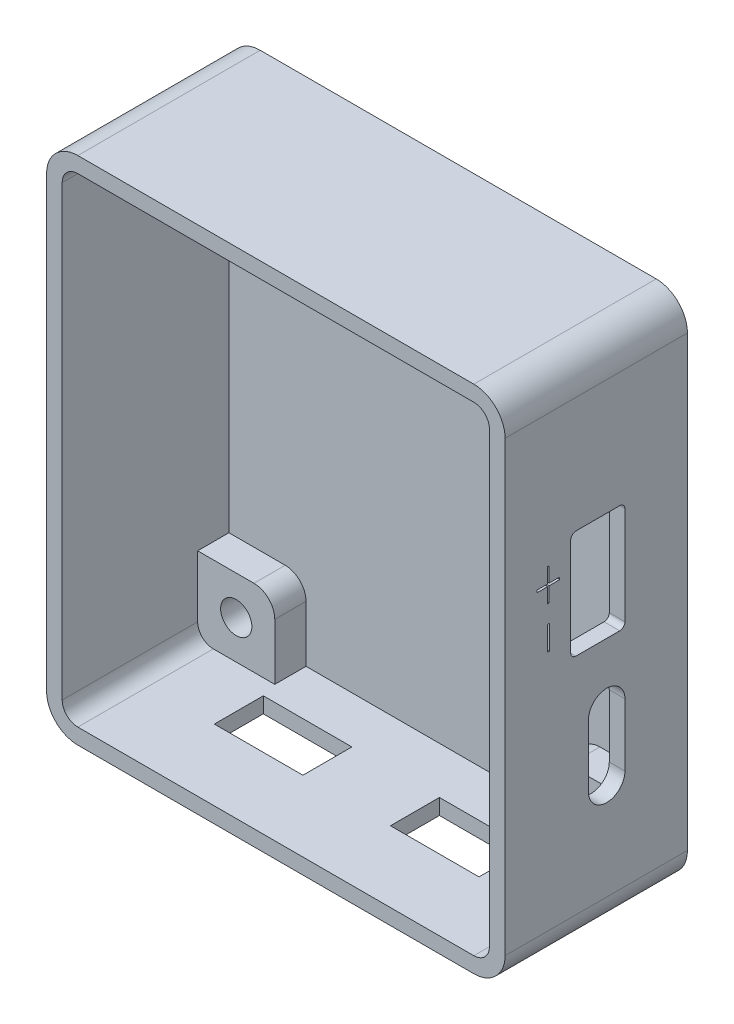
from build123d import *

# Parameters (mm, degrees)
EXTRUDE_1_DEPTH     = 1.5
EXTRUDE_2_DEPTH     = 16
SKETCH_6_R          = 1.5
EXTRUDE_4_DEPTH     = 3
CUT_EXTRUDE_1_DEPTH = 1.5
SKETCH_9_W          = 8.5
SKETCH_9_H          = 4.7
CUT_EXTRUDE_2_DEPTH = 1.5
CUT_EXTRUDE_3_DEPTH = 0.4
SKETCH_11_W         = 0.167941
SKETCH_11_H         = 2.323183833
CUT_EXTRUDE_4_DEPTH = 0.4


with BuildPart() as part:
    # 草图1 → 凸台-拉伸1 (new body)
    with BuildSketch(Plane.XY):
        with BuildLine():
            Line((-19, -24.5), (19, -24.5))
            ThreePointArc((19, -24.5), (21.121320344, -23.621320344), (22, -21.5))
            Line((22, -21.5), (22, 21.5))
            ThreePointArc((22, 21.5), (21.121320344, 23.621320344), (19, 24.5))
            Line((19, 24.5), (-19, 24.5))
            ThreePointArc((-19, 24.5), (-21.121320344, 23.621320344), (-22, 21.5))
            Line((-22, 21.5), (-22, -21.5))
            ThreePointArc((-22, -21.5), (-21.121320344, -23.621320344), (-19, -24.5))
        make_face()
    extrude(amount=EXTRUDE_1_DEPTH)

    # 草图4 → 凸台-拉伸2 (add)
    with BuildSketch(Plane.XY.offset(1.5)):
        with BuildLine():
            Line((-19, -24.5), (19, -24.5))
            ThreePointArc((19, -24.5), (21.121320344, -23.621320344), (22, -21.5))
            Line((22, -21.5), (22, 21.5))
            ThreePointArc((22, 21.5), (21.121320344, 23.621320344), (19, 24.5))
            Line((19, 24.5), (-19, 24.5))
            ThreePointArc((-19, 24.5), (-21.121320344, 23.621320344), (-22, 21.5))
            Line((-22, 21.5), (-22, -21.5))
            ThreePointArc((-22, -21.5), (-21.121320344, -23.621320344), (-19, -24.5))
        make_face()
        with BuildLine():
            Line((20.5, -21.5), (20.5, 21.5))
            ThreePointArc((20.5, 21.5), (20.060660172, 22.560660172), (19, 23))
            Line((19, 23), (-19, 23))
            ThreePointArc((-19, 23), (-20.060660172, 22.560660172), (-20.5, 21.5))
            Line((-20.5, 21.5), (-20.5, -21.5))
            ThreePointArc((-20.5, -21.5), (-20.060660172, -22.560660172), (-19, -23))
            Line((-19, -23), (19, -23))
            ThreePointArc((19, -23), (20.060660172, -22.560660172), (20.5, -21.5))
        make_face(mode=Mode.SUBTRACT)
    extrude(amount=EXTRUDE_2_DEPTH)

    # 草图6 → 凸台-拉伸4 (add)
    # profile 1 of 4: a face of its own
    with BuildSketch(Plane.XY.offset(1.5)):
        with BuildLine():
            Line((-13.1, 17.6), (-13.1, 23))
            Line((-13.1, 23), (-19, 23))
            ThreePointArc((-19, 23), (-20.060660172, 22.560660172), (-20.5, 21.5))
            Line((-20.5, 21.5), (-20.5, 15.6))
            Line((-20.5, 15.6), (-15.1, 15.6))
            ThreePointArc((-15.1, 15.6), (-13.685786438, 16.185786438), (-13.1, 17.6))
        make_face()
        with Locations((-16.8, 19.3)):
            Circle(SKETCH_6_R, mode=Mode.SUBTRACT)
    # profile 2 of 4: a face of its own
    with BuildSketch(Plane.XY.offset(1.5)):
        with BuildLine():
            Line((19, 23), (13.1, 23))
            Line((13.1, 23), (13.1, 17.6))
            ThreePointArc((13.1, 17.6), (13.685786438, 16.185786438), (15.1, 15.6))
            Line((15.1, 15.6), (20.5, 15.6))
            Line((20.5, 15.6), (20.5, 21.5))
            ThreePointArc((20.5, 21.5), (20.060660172, 22.560660172), (19, 23))
        make_face()
        with Locations((16.8, 19.3)):
            Circle(SKETCH_6_R, mode=Mode.SUBTRACT)
    # profile 3 of 4: a face of its own
    with BuildSketch(Plane.XY.offset(1.5)):
        with BuildLine():
            Line((-15.1, -15.6), (-20.5, -15.6))
            Line((-20.5, -15.6), (-20.5, -21.5))
            ThreePointArc((-20.5, -21.5), (-20.060660172, -22.560660172), (-19, -23))
            Line((-19, -23), (-13.1, -23))
            Line((-13.1, -23), (-13.1, -17.6))
            ThreePointArc((-13.1, -17.6), (-13.685786438, -16.185786438), (-15.1, -15.6))
        make_face()
        with Locations((-16.8, -19.3)):
            Circle(SKETCH_6_R, mode=Mode.SUBTRACT)
    # profile 4 of 4: a face of its own
    with BuildSketch(Plane.XY.offset(1.5)):
        with BuildLine():
            Line((20.5, -21.5), (20.5, -15.6))
            Line((20.5, -15.6), (15.1, -15.6))
            ThreePointArc((15.1, -15.6), (13.685786438, -16.185786438), (13.1, -17.6))
            Line((13.1, -17.6), (13.1, -23))
            Line((13.1, -23), (19, -23))
            ThreePointArc((19, -23), (20.060660172, -22.560660172), (20.5, -21.5))
        make_face()
        with Locations((16.8, -19.3)):
            Circle(SKETCH_6_R, mode=Mode.SUBTRACT)
    extrude(amount=EXTRUDE_4_DEPTH)

    # 草图7 → 切除-拉伸1 (cut)
    with BuildSketch(Plane(origin=(22, 0, 0), x_dir=(0, 0, -1), z_dir=(1, 0, 0))):
        with BuildLine():
            Line((-10.7, 10.4), (-6.5, 10.4))
            ThreePointArc((-6.5, 10.4), (-6.146446609, 10.253553391), (-6, 9.9))
            Line((-6, 9.9), (-6, 0.5))
            ThreePointArc((-6, 0.5), (-6.146446609, 0.146446609), (-6.5, 0))
            Line((-6.5, 0), (-10.7, 0))
            ThreePointArc((-10.7, 0), (-11.053553391, 0.146446609), (-11.2, 0.5))
            Line((-11.2, 0.5), (-11.2, 9.9))
            ThreePointArc((-11.2, 9.9), (-11.053553391, 10.253553391), (-10.7, 10.4))
        make_face()
        with BuildLine():
            Line((-6, -5.9), (-6, -11.9))
            ThreePointArc((-6, -11.9), (-7.75, -13.65), (-9.5, -11.9))
            Line((-9.5, -11.9), (-9.5, -5.9))
            ThreePointArc((-9.5, -5.9), (-7.75, -4.15), (-6, -5.9))
        make_face()
    extrude(amount=-CUT_EXTRUDE_1_DEPTH, mode=Mode.SUBTRACT)

    # 草图9 → 切除-拉伸2 (cut)
    with BuildSketch(Plane.XZ.offset(24.5)):
        with Locations((-8.45, 8.35)):
            Rectangle(SKETCH_9_W, SKETCH_9_H)
        with Locations((8.45, 8.35)):
            Rectangle(SKETCH_9_W, SKETCH_9_H)
    extrude(amount=-CUT_EXTRUDE_2_DEPTH, mode=Mode.SUBTRACT)

    # 草图10 → 切除-拉伸3 (cut)
    with BuildSketch(Plane.XZ.offset(24.5)):
        with BuildLine():
            Line((5.146024561, 15.278113511), (5.181076766, 15.318386258))
            Line((5.181076766, 15.318386258), (5.402576872, 15.041697573))
            add(Edge.make_bspline(
                [(5.402576872, 15.041697573), (5.396175093, 15.029735511), (5.383530326, 15.006108099), (5.362631994, 14.969707555), (5.346248836, 14.924148855), (5.335651242, 14.866845568), (5.328158802, 14.798513844), (5.327563807, 14.749619769), (5.32725192, 14.723990349)],
                knots=[0, 0, 0, 0, 0.736410598, 1.454555069, 2.274010016, 3.348139226, 4.609940921, 6, 6, 6, 6], degree=3))
            Line((5.32725192, 14.723990349), (5.32725192, 12.156975646))
            add(Edge.make_bspline(
                [(5.32725192, 12.156975646), (5.347889467, 12.156755128), (5.385690735, 12.156351211), (5.436370188, 12.158787957), (5.475961496, 12.158570324), (5.508306264, 12.16126774), (5.542791059, 12.165884302), (5.58751146, 12.171810361), (5.647268407, 12.179055459), (5.716844174, 12.189019446), (5.78743923, 12.19951043), (5.849133517, 12.208952893), (5.89708996, 12.217378293), (5.942200811, 12.225183856), (5.986499646, 12.24055664), (6.025373314, 12.268914573), (6.05036684, 12.297684791), (6.06982158, 12.30500879), (6.076772483, 12.30762555)],
                knots=[0, 0, 0, 0, 1.271684107, 2.329311289, 3.126176351, 3.710204741, 4.32783396, 5.270448411, 6.49050515, 8.03759688, 9.602040843, 10.889228832, 11.884182716, 12.602334394, 13.712376462, 14.732953672, 15.547302315, 16, 16, 16, 16], degree=3))
            add(Edge.make_bspline(
                [(6.076772483, 12.30762555), (6.080022607, 12.305162426), (6.08946356, 12.298007547), (6.108330709, 12.281752984), (6.139611472, 12.255975297), (6.177541129, 12.219223825), (6.21647205, 12.183206306), (6.247439777, 12.154585227), (6.269681945, 12.134169304), (6.278294564, 12.113029312), (6.281887459, 12.095947906), (6.282921417, 12.085886832), (6.283356757, 12.081650694)],
                knots=[0, 0, 0, 0, 0.390394386, 1.134016561, 2.38360509, 4.269889804, 6.18981564, 7.453157385, 8.329021544, 9.032311711, 9.592562279, 10, 10, 10, 10], degree=3))
            add(Edge.make_bspline(
                [(6.283356757, 12.081650694), (6.281275092, 12.076854821), (6.277089785, 12.067212444), (6.262302219, 12.057859746), (6.243193914, 12.052892807), (6.209951113, 12.053453591), (6.162321804, 12.055027694), (6.100540552, 12.045441014), (6.034228292, 12.036243207), (5.981590364, 12.028012382), (5.941598849, 12.022204449), (5.91243486, 12.019632793), (5.875705667, 12.015509976), (5.831143515, 12.012206987), (5.778952505, 12.00757784), (5.719036337, 12.002403274), (5.651454191, 11.996253714), (5.603697238, 11.992590475), (5.578583691, 11.990664118)],
                knots=[0, 0, 0, 0, 0.341365878, 0.68633572, 1.116730632, 1.647491765, 2.890856209, 4.29325764, 5.800779701, 7.359923239, 7.845242571, 8.495183841, 9.311733456, 10.309872826, 11.474601469, 12.805924266, 14.320358265, 16, 16, 16, 16], degree=3))
            Line((5.578583691, 11.990664118), (5.367524667, 11.970527745))
            Line((5.367524667, 11.970527745), (5.251181177, 11.960832454))
            add(Edge.make_bspline(
                [(5.251181177, 11.960832454), (5.239070364, 11.956886365), (5.219441583, 11.950490682), (5.190494871, 11.954610985), (5.177929545, 11.971369132), (5.168194509, 11.989750384), (5.168929417, 12.018407574), (5.174324128, 12.058165715), (5.181300645, 12.112891189), (5.18451738, 12.15423507), (5.186297307, 12.17711202)],
                knots=[0, 0, 0, 0, 1.058270145, 1.715207142, 2.242218181, 2.723015089, 3.427046488, 4.550153686, 6.091084828, 8, 8, 8, 8], degree=3))
            Line((5.186297307, 12.17711202), (5.195992598, 12.473937078))
            Line((5.195992598, 12.473937078), (5.195992598, 14.739651973))
            add(Edge.make_bspline(
                [(5.195992598, 14.739651973), (5.196098197, 14.767744499), (5.196287906, 14.818212984), (5.195184409, 14.885078006), (5.194983446, 14.934822413), (5.192720015, 14.979312106), (5.190011615, 15.026566112), (5.185920415, 15.085160746), (5.176566789, 15.153443123), (5.163106419, 15.201195107), (5.155719851, 15.227399682)],
                knots=[0, 0, 0, 0, 1.372323329, 2.465391677, 3.267017655, 3.801925377, 4.641299591, 5.579257235, 6.671583216, 8, 8, 8, 8], degree=3))
            Line((5.155719851, 15.227399682), (5.146024561, 15.278113511))
        make_face()
        with BuildLine():
            Line((6.897143248, 13.621710358), (7.798059506, 13.727612765))
            Line((7.798059506, 13.727612765), (7.798059506, 14.618833733))
            add(Edge.make_bspline(
                [(7.798059506, 14.618833733), (7.797711949, 14.650410123), (7.796948245, 14.719794481), (7.793197244, 14.808499891), (7.791314667, 14.88241817), (7.786945045, 14.932314818), (7.78402757, 14.974492431), (7.776531571, 15.019931705), (7.76719628, 15.071774204), (7.757951258, 15.111835287), (7.75331201, 15.131938357)],
                knots=[0, 0, 0, 0, 1.46744149, 3.224481516, 4.126299343, 4.90251787, 5.552072189, 6.089638665, 7.041360766, 8, 8, 8, 8], degree=3))
            Line((7.75331201, 15.131938357), (7.733175637, 15.21248385))
            Line((7.733175637, 15.21248385), (7.777923133, 15.263197679))
            Line((7.777923133, 15.263197679), (7.99494849, 14.961152079))
            add(Edge.make_bspline(
                [(7.99494849, 14.961152079), (7.989062778, 14.944307568), (7.978581883, 14.914311949), (7.965460017, 14.869157881), (7.957434238, 14.819265556), (7.949338461, 14.769888899), (7.943587522, 14.719114673), (7.940859156, 14.670824913), (7.939580261, 14.614614758), (7.93921122, 14.574584061), (7.939014119, 14.553204072)],
                knots=[0, 0, 0, 0, 1.034161492, 1.841568026, 2.720364137, 3.95915506, 4.741893149, 5.680086666, 6.760957793, 8, 8, 8, 8], degree=3))
            Line((7.939014119, 14.553204072), (7.939014119, 12.519430366))
            Line((7.939014119, 12.519430366), (7.918877746, 11.980968828))
            add(Edge.make_bspline(
                [(7.918877746, 11.980968828), (7.918119987, 11.968542495), (7.916740321, 11.945917671), (7.915020183, 11.914998395), (7.911418071, 11.890523979), (7.909508477, 11.867560409), (7.904118565, 11.848624565), (7.899885492, 11.833095206), (7.888898215, 11.826767605), (7.8855927, 11.831997645), (7.883825541, 11.834793673)],
                knots=[0, 0, 0, 0, 1.782056354, 3.244618926, 4.42725805, 5.323067691, 6.531120047, 7.247096294, 7.597490544, 8, 8, 8, 8], degree=3))
            add(Edge.make_bspline(
                [(7.883825541, 11.834793673), (7.880331531, 11.838377738), (7.868373633, 11.850643842), (7.865630662, 11.868001256), (7.863689167, 11.880286961)],
                knots=[0, 0, 0, 0, 0.584385278, 2, 2, 2, 2], degree=3))
            Line((7.863689167, 11.880286961), (7.833857503, 11.940696081))
            Line((7.833857503, 11.940696081), (7.773448383, 12.1167029))
            add(Edge.make_bspline(
                [(7.773448383, 12.1167029), (7.7667526, 12.132541817), (7.755121076, 12.160056262), (7.742799339, 12.196469589), (7.733861311, 12.221367176), (7.734763318, 12.243363036), (7.746372418, 12.264462493), (7.756465947, 12.295448494), (7.769040254, 12.334694826), (7.778134096, 12.381332961), (7.786939076, 12.429267473), (7.793015467, 12.475078757), (7.796828372, 12.516875626), (7.798166388, 12.548754781), (7.798028288, 12.575116284), (7.798073809, 12.60022439), (7.798053658, 12.635773884), (7.798061679, 12.681764329), (7.798058749, 12.738444504), (7.798059759, 12.805565744), (7.798059429, 12.883128072), (7.798059479, 12.938316651), (7.798059506, 12.96765112)],
                knots=[0, 0, 0, 0, 1.190143081, 2.067447299, 2.673393139, 3.001188833, 3.557860616, 4.310020916, 5.263836027, 6.409373277, 7.599017452, 8.641879088, 9.610516428, 10.507063897, 10.85163508, 11.437406092, 12.247148373, 13.315319042, 14.624689539, 16.175259864, 17.967030018, 20, 20, 20, 20], degree=3))
            Line((7.798059506, 12.96765112), (7.798059506, 13.541164864))
            Line((7.798059506, 13.541164864), (6.891922707, 13.430787707))
            Line((6.891922707, 13.430787707), (6.897143248, 12.343423547))
            add(Edge.make_bspline(
                [(6.897143248, 12.343423547), (6.896913713, 12.314826361), (6.896400347, 12.25086722), (6.889383353, 12.15199213), (6.884188204, 12.053885325), (6.879336895, 11.969081429), (6.876663028, 11.903874741), (6.86805492, 11.85385666), (6.860720208, 11.82602751), (6.848674236, 11.802089564), (6.831552878, 11.815546689), (6.828868708, 11.826991461), (6.827038837, 11.834793673)],
                knots=[0, 0, 0, 0, 1.480742141, 3.311759243, 5.1299228, 6.573886411, 7.696591102, 8.545303974, 9.099038742, 9.382560764, 9.579074942, 10, 10, 10, 10], degree=3))
            Line((6.827038837, 11.834793673), (6.79124084, 11.940696081))
            Line((6.79124084, 11.940696081), (6.73083172, 12.126398191))
            add(Edge.make_bspline(
                [(6.73083172, 12.126398191), (6.726519884, 12.138055042), (6.718852329, 12.158783923), (6.709696747, 12.186815603), (6.703750156, 12.207891409), (6.702458073, 12.229798238), (6.709556641, 12.257092849), (6.719124479, 12.297144516), (6.732645655, 12.350262939), (6.743695939, 12.414110252), (6.754494276, 12.479359415), (6.757834965, 12.527846317), (6.759294906, 12.560691539), (6.760208302, 12.584306957), (6.75959971, 12.61489751), (6.761077355, 12.652174713), (6.760310254, 12.696187744), (6.761764139, 12.746892257), (6.761301707, 12.80457218), (6.761371926, 12.845341583), (6.761409176, 12.866969254)],
                knots=[0, 0, 0, 0, 0.89440678, 1.590485457, 2.124353431, 2.464834642, 3.156297362, 4.132862491, 5.439341602, 7.095985926, 8.796698138, 10.196654753, 10.590757748, 11.163686739, 11.89739384, 12.792337533, 13.848159947, 15.065171594, 16.443109321, 18, 18, 18, 18], degree=3))
            Line((6.761409176, 12.866969254), (6.761409176, 14.60839265))
            add(Edge.make_bspline(
                [(6.761409176, 14.60839265), (6.761180746, 14.639972913), (6.760682168, 14.708901078), (6.75513461, 14.796860486), (6.750405393, 14.869926589), (6.747022523, 14.92045148), (6.742114327, 14.964121008), (6.737661679, 15.012208605), (6.731218604, 15.062549089), (6.72426086, 15.100141396), (6.721136429, 15.117022525)],
                knots=[0, 0, 0, 0, 1.483614415, 3.238187741, 4.139484673, 4.924258038, 5.616965174, 6.203905796, 7.193449433, 8, 8, 8, 8], degree=3))
            Line((6.721136429, 15.117022525), (6.695779515, 15.202788559))
            Line((6.695779515, 15.202788559), (6.741272803, 15.247536055))
            Line((6.741272803, 15.247536055), (6.962772909, 14.950710997))
            add(Edge.make_bspline(
                [(6.962772909, 14.950710997), (6.956671103, 14.934104626), (6.945633641, 14.904065619), (6.931206578, 14.858698755), (6.919883021, 14.80703189), (6.908912172, 14.743154999), (6.898518865, 14.667852556), (6.897603611, 14.614893937), (6.897143248, 14.588256277)],
                knots=[0, 0, 0, 0, 0.859882532, 1.555428207, 2.311609949, 3.427964232, 4.7062915, 6, 6, 6, 6], degree=3))
            Line((6.897143248, 14.588256277), (6.897143248, 13.621710358))
        make_face()
        with BuildLine():
            add(Edge.make_bspline(
                [(9.637181603, 13.304748926), (9.624198427, 13.299660481), (9.600848856, 13.290509177), (9.570651009, 13.276693953), (9.548013603, 13.267338105), (9.535986258, 13.261529078), (9.531279195, 13.259255638)],
                knots=[0, 0, 0, 0, 1.451194949, 2.609899258, 3.455965341, 4, 4, 4, 4], degree=3))
            Line((9.531279195, 13.259255638), (9.470870075, 13.229423974))
            Line((9.470870075, 13.229423974), (9.329915462, 13.359937504))
            add(Edge.make_bspline(
                [(9.329915462, 13.359937504), (9.321141216, 13.366489689), (9.307866097, 13.37640291), (9.294251725, 13.396254268), (9.301084334, 13.408375801), (9.303637594, 13.419033393), (9.313722224, 13.425808191), (9.321189437, 13.42898122), (9.325440712, 13.430787707)],
                knots=[0, 0, 0, 0, 2.086102323, 3.156198184, 3.883632954, 4.481724143, 5.135606675, 6, 6, 6, 6], degree=3))
            Line((9.325440712, 13.430787707), (9.446258952, 13.430787707))
            Line((9.446258952, 13.430787707), (9.551415568, 13.45539883))
            Line((9.551415568, 13.45539883), (9.682674891, 13.480755744))
            add(Edge.make_bspline(
                [(9.682674891, 13.480755744), (9.69195376, 13.482230602), (9.716117457, 13.486071374), (9.752502786, 13.50099809), (9.790424159, 13.515400485), (9.806831711, 13.533970399), (9.813188422, 13.541164864)],
                knots=[0, 0, 0, 0, 0.766069967, 1.994971973, 3.223200239, 4, 4, 4, 4], degree=3))
            Line((9.813188422, 13.541164864), (9.843765877, 13.591878693))
            Line((9.843765877, 13.591878693), (9.994415782, 13.45539883))
            add(Edge.make_bspline(
                [(9.994415782, 13.45539883), (10.000116561, 13.448513691), (10.011118224, 13.43522639), (10.01507703, 13.411807305), (10.014925911, 13.391766645), (10.007716377, 13.383394511), (10.004856864, 13.380073878)],
                knots=[0, 0, 0, 0, 1.265348548, 2.441935808, 3.382026096, 4, 4, 4, 4], degree=3))
            Line((10.004856864, 13.380073878), (9.969804659, 13.374853336))
            Line((9.969804659, 13.374853336), (9.778136216, 13.345021672))
            Line((9.778136216, 13.345021672), (9.778136216, 12.091345985))
            add(Edge.make_bspline(
                [(9.778136216, 12.091345985), (9.778212266, 12.076925607), (9.7783552, 12.049822803), (9.777436694, 12.012300254), (9.776702464, 11.980691837), (9.776061277, 11.955416527), (9.775111228, 11.935710539), (9.772322352, 11.923025529), (9.771485366, 11.914592213), (9.762269758, 11.908688297), (9.752725927, 11.938247868), (9.734076073, 11.955751873), (9.718428876, 11.985718159), (9.710906686, 12.003865009), (9.708031805, 12.010800492)],
                knots=[0, 0, 0, 0, 1.751209942, 3.291362944, 4.559839881, 5.586855149, 6.374199429, 6.925174992, 7.211613548, 7.320476949, 8.136254313, 9.593373124, 11.080219477, 12, 12, 12, 12], degree=3))
            Line((9.708031805, 12.010800492), (9.682674891, 12.076430153))
            Line((9.682674891, 12.076430153), (9.637181603, 12.162196188))
            add(Edge.make_bspline(
                [(9.637181603, 12.162196188), (9.630028776, 12.175568683), (9.617326546, 12.199316009), (9.613497527, 12.225904882), (9.611824688, 12.23752114)],
                knots=[0, 0, 0, 0, 1.126231633, 2, 2, 2, 2], degree=3))
            Line((9.611824688, 12.23752114), (9.627486312, 12.287489177))
            Line((9.627486312, 12.287489177), (9.657317976, 12.468716537))
            add(Edge.make_bspline(
                [(9.657317976, 12.468716537), (9.65149818, 12.453837657), (9.637228129, 12.417354875), (9.61583322, 12.353408303), (9.586086787, 12.274987078), (9.552221437, 12.20510853), (9.518381312, 12.147710089), (9.483886975, 12.108882414), (9.443975483, 12.073387517), (9.39834325, 12.042490123), (9.348659167, 12.017819376), (9.297340714, 11.997324534), (9.243609179, 11.985837677), (9.207150595, 11.982589429), (9.188960849, 11.980968828)],
                knots=[0, 0, 0, 0, 0.787433887, 1.930775596, 3.32352342, 4.918383998, 5.754919964, 6.59762641, 7.465700887, 8.383390173, 9.30410181, 10.196234789, 11.100073855, 12, 12, 12, 12], degree=3))
            add(Edge.make_bspline(
                [(9.188960849, 11.980968828), (9.155840046, 11.979390932), (9.089799386, 11.976244715), (8.99254153, 11.995156786), (8.902682082, 12.030124161), (8.832697713, 12.068333939), (8.782599326, 12.108404073), (8.746836407, 12.145029853), (8.710674712, 12.186565047), (8.676631468, 12.235669503), (8.642832101, 12.291112186), (8.610299276, 12.354166172), (8.57763205, 12.4240375), (8.545415701, 12.500693275), (8.515988002, 12.583655922), (8.489129574, 12.672312449), (8.464463783, 12.766041713), (8.436590044, 12.895907642), (8.409215444, 13.054578995), (8.388986282, 13.241195101), (8.381081579, 13.427477435), (8.377664706, 13.622950794), (8.382509055, 13.830696194), (8.396500413, 13.972295143), (8.403642289, 14.044574197)],
                knots=[0, 0, 0, 0, 0.886537814, 1.767696987, 2.630539397, 3.466390029, 3.89319088, 4.345660666, 4.837284351, 5.368061509, 5.945350042, 6.577414686, 7.26921622, 8.013189797, 8.805909171, 9.628228833, 10.496409839, 11.40375193, 13.18882713, 14.811163384, 16.432855943, 18.186087669, 20.053191931, 22, 22, 22, 22], degree=3))
            add(Edge.make_bspline(
                [(8.403642289, 14.044574197), (8.411986092, 14.104828903), (8.429171782, 14.228935219), (8.460608707, 14.384144356), (8.493749689, 14.509890026), (8.52350959, 14.603372073), (8.558507608, 14.694318399), (8.598234421, 14.781313035), (8.641162408, 14.861311322), (8.686393621, 14.931490364), (8.734290355, 14.989518614), (8.783678099, 15.036017384), (8.832444762, 15.071993288), (8.876712794, 15.101474859), (8.917709686, 15.123030896), (8.967740794, 15.142009576), (9.031251407, 15.155154478), (9.082261417, 15.160020763), (9.108415355, 15.162515812)],
                knots=[0, 0, 0, 0, 2.031066659, 4.183377905, 5.28281558, 6.372336155, 7.457674051, 8.534949753, 9.563865233, 10.48716063, 11.318346232, 12.070077728, 12.745820699, 13.339884663, 13.84484432, 14.288876811, 15.122670028, 16, 16, 16, 16], degree=3))
            add(Edge.make_bspline(
                [(9.108415355, 15.162515812), (9.124856992, 15.162184899), (9.156927277, 15.161539435), (9.203634651, 15.153606071), (9.247916064, 15.141778228), (9.304411149, 15.119564077), (9.371977718, 15.078876671), (9.429517537, 15.023638834), (9.471347037, 14.977277462), (9.498875022, 14.946747442), (9.519767692, 14.91987597), (9.531344156, 14.903026384), (9.536499736, 14.895522418)],
                knots=[0, 0, 0, 0, 0.935591886, 1.824921544, 2.69059853, 3.542616212, 5.276632114, 7.140836838, 8.062935201, 8.835586858, 9.48142842, 10, 10, 10, 10], degree=3))
            Line((9.536499736, 14.895522418), (9.576772483, 14.814976925))
            Line((9.576772483, 14.814976925), (9.637181603, 15.172211103))
            Line((9.637181603, 15.172211103), (9.697590723, 15.172211103))
            Line((9.697590723, 15.172211103), (9.697590723, 13.808158259))
            Line((9.697590723, 13.808158259), (9.591688315, 13.802937717))
            add(Edge.make_bspline(
                [(9.591688315, 13.802937717), (9.591670417, 13.826803044), (9.591632012, 13.878014059), (9.591959465, 13.958315284), (9.590607536, 14.04361482), (9.587397234, 14.116951028), (9.583554606, 14.178859988), (9.578731455, 14.231515878), (9.573987515, 14.290781883), (9.563705486, 14.375280308), (9.551885502, 14.477661285), (9.528437169, 14.59109438), (9.496448711, 14.695176575), (9.455437741, 14.773988289), (9.418963113, 14.834129771), (9.38710382, 14.872012257), (9.354239291, 14.905075067), (9.306325709, 14.939548544), (9.238233978, 14.971867515), (9.179168681, 14.98103324), (9.148688102, 14.985763202)],
                knots=[0, 0, 0, 0, 0.934719612, 2.005752502, 3.145108456, 4.275610044, 4.880538166, 5.574305271, 6.346515312, 7.208856073, 8.908119904, 10.380417914, 11.741392999, 13.156562568, 13.848071288, 14.491354542, 15.090376944, 15.668787155, 16.796980267, 18, 18, 18, 18], degree=3))
            add(Edge.make_bspline(
                [(9.148688102, 14.985763202), (9.125021749, 14.985754329), (9.079084572, 14.985737104), (9.01176988, 14.973355304), (8.949227371, 14.950891322), (8.890208023, 14.918984587), (8.83552168, 14.875529016), (8.785766774, 14.819128043), (8.738390801, 14.75150708), (8.696754706, 14.672474557), (8.658583909, 14.587439394), (8.625780858, 14.498898503), (8.597806034, 14.408637841), (8.570321205, 14.287512406), (8.545264817, 14.139354607), (8.528204416, 13.966095936), (8.52132016, 13.798029679), (8.52042977, 13.687344431), (8.519985779, 13.63215144)],
                knots=[0, 0, 0, 0, 0.687070091, 1.333625864, 1.978401157, 2.612429783, 3.276252408, 3.997857604, 4.791996822, 5.671793893, 6.590722303, 7.501081097, 8.415734735, 9.336282353, 11.110559688, 12.781456087, 14.395079127, 16, 16, 16, 16], degree=3))
            add(Edge.make_bspline(
                [(8.519985779, 13.63215144), (8.521195724, 13.559032299), (8.523701532, 13.407601787), (8.53948132, 13.217365908), (8.557905905, 13.063611894), (8.574568004, 12.953263708), (8.595823787, 12.850427742), (8.618491219, 12.755021202), (8.643937278, 12.668417065), (8.669341016, 12.59092145), (8.693568335, 12.522406428), (8.719116425, 12.462929488), (8.745575025, 12.410654785), (8.772831305, 12.364255919), (8.802403232, 12.323623182), (8.841591697, 12.277034747), (8.894581783, 12.231367289), (8.960258229, 12.187654501), (9.032126413, 12.160238094), (9.082583634, 12.154627477), (9.108415355, 12.151755105)],
                knots=[0, 0, 0, 0, 2.298361562, 4.759931027, 5.995784954, 7.166237941, 8.266635837, 9.295830317, 10.247969411, 11.103023622, 11.859473385, 12.531579901, 13.136194532, 13.700421914, 14.220962996, 14.714278152, 15.611161906, 16.408908565, 17.185436095, 18, 18, 18, 18], degree=3))
            add(Edge.make_bspline(
                [(9.108415355, 12.151755105), (9.132085504, 12.151439034), (9.179596894, 12.150804606), (9.250828565, 12.164780815), (9.31980949, 12.192037557), (9.38407143, 12.236149411), (9.441730418, 12.296172681), (9.491864761, 12.371397456), (9.534146599, 12.458328917), (9.563348144, 12.555131773), (9.585590992, 12.65546031), (9.599541955, 12.757392131), (9.610260874, 12.856208416), (9.619614449, 12.952909324), (9.627554902, 13.051083019), (9.630450297, 13.11828727), (9.631961062, 13.15335323)],
                knots=[0, 0, 0, 0, 0.783104963, 1.571870426, 2.389098297, 3.225710409, 4.134881124, 5.131509479, 6.211508184, 7.327051887, 8.474825503, 9.6158629, 10.735296491, 11.77020564, 12.836533725, 14, 14, 14, 14], degree=3))
            Line((9.631961062, 13.15335323), (9.637181603, 13.304748926))
        make_face()
        with BuildLine():
            Line((11.456167326, 15.243061306), (11.511355905, 15.267672429))
            Line((11.511355905, 15.267672429), (11.687362724, 14.955931538))
            add(Edge.make_bspline(
                [(11.687362724, 14.955931538), (11.678444904, 14.940750003), (11.662530672, 14.913657905), (11.638682507, 14.87405724), (11.616343811, 14.829553024), (11.596649065, 14.784507171), (11.579264225, 14.737767959), (11.568169835, 14.692559999), (11.555680363, 14.640551056), (11.549623032, 14.602977736), (11.546408111, 14.583035736)],
                knots=[0, 0, 0, 0, 1.050845495, 1.875278674, 2.7577401, 4.020108455, 4.808513078, 5.729779683, 6.795082978, 8, 8, 8, 8], degree=3))
            Line((11.546408111, 14.583035736), (11.018387655, 11.900423334))
            Line((11.018387655, 11.900423334), (10.927401079, 11.895202793))
            Line((10.927401079, 11.895202793), (10.383718999, 14.688938144))
            add(Edge.make_bspline(
                [(10.383718999, 14.688938144), (10.381096973, 14.70089893), (10.375388099, 14.726940868), (10.363564295, 14.768419678), (10.351471608, 14.816445947), (10.335944564, 14.867668144), (10.321156859, 14.918743044), (10.306911476, 14.964383083), (10.295255341, 15.003180502), (10.280745277, 15.042947836), (10.264987936, 15.084160171), (10.249716906, 15.113403881), (10.242764386, 15.126717815)],
                knots=[0, 0, 0, 0, 0.796855161, 1.734973822, 2.806513648, 4.020139396, 5.218239302, 6.267555842, 7.132481218, 7.85415497, 9.023050118, 10, 10, 10, 10], degree=3))
            Line((10.242764386, 15.126717815), (10.20771218, 15.192347477))
            Line((10.20771218, 15.192347477), (10.242764386, 15.252756597))
            Line((10.242764386, 15.252756597), (10.50975778, 15.061833946))
            add(Edge.make_bspline(
                [(10.50975778, 15.061833946), (10.505453963, 15.042760282), (10.497348841, 15.006839992), (10.490462227, 14.952375576), (10.492161286, 14.894603714), (10.498897849, 14.829107211), (10.511834865, 14.754328152), (10.520260727, 14.701624726), (10.524673612, 14.674022312)],
                knots=[0, 0, 0, 0, 0.898331485, 1.691773928, 2.514283857, 3.547449524, 4.715523432, 6, 6, 6, 6], degree=3))
            Line((10.524673612, 14.674022312), (10.972894367, 12.393391585))
            Line((10.972894367, 12.393391585), (11.421115121, 14.688938144))
            add(Edge.make_bspline(
                [(11.421115121, 14.688938144), (11.426026257, 14.717995785), (11.436621386, 14.780683825), (11.446760242, 14.860901405), (11.454607411, 14.926799059), (11.458997455, 14.972081462), (11.462700137, 15.011113635), (11.464875861, 15.035233318), (11.465862617, 15.046172322)],
                knots=[0, 0, 0, 0, 1.472770085, 3.177307748, 4.040376616, 4.789595524, 5.451045058, 6, 6, 6, 6], degree=3))
            add(Edge.make_bspline(
                [(11.465862617, 15.046172322), (11.465884794, 15.06607069), (11.465928081, 15.104911893), (11.462876246, 15.143632024), (11.461387868, 15.162515812)],
                knots=[0, 0, 0, 0, 1.024601013, 2, 2, 2, 2], degree=3))
            Line((11.461387868, 15.162515812), (11.456167326, 15.243061306))
        make_face()
        with BuildLine():
            Line((-10.553663941, 14.95870173), (-10.517865944, 15.255526789))
            Line((-10.517865944, 15.255526789), (-10.442540992, 15.255526789))
            Line((-10.442540992, 15.255526789), (-10.442540992, 13.911610318))
            Line((-10.442540992, 13.911610318), (-10.538002318, 13.911610318))
            add(Edge.make_bspline(
                [(-10.538002318, 13.911610318), (-10.538132927, 13.935975174), (-10.53840619, 13.986951545), (-10.541322545, 14.068466823), (-10.543184138, 14.161459463), (-10.546352471, 14.266362778), (-10.549329722, 14.378682989), (-10.560319772, 14.493694108), (-10.577120882, 14.609930656), (-10.602760543, 14.726523458), (-10.636477302, 14.838956911), (-10.676314955, 14.924533248), (-10.7135117, 14.984620539), (-10.743981722, 15.023681729), (-10.777945215, 15.05696364), (-10.826547889, 15.093174962), (-10.892928376, 15.129657112), (-10.951670636, 15.139990059), (-10.981002531, 15.145149632)],
                knots=[0, 0, 0, 0, 0.822473136, 1.720785642, 2.753326599, 3.962261781, 5.264018637, 6.545024146, 7.860049611, 9.226346671, 10.572050264, 11.814683136, 12.399128484, 12.954850798, 13.483022901, 13.998303406, 15.000488703, 16, 16, 16, 16], degree=3))
            add(Edge.make_bspline(
                [(-10.981002531, 15.145149632), (-11.003428091, 15.145747876), (-11.048184893, 15.146941848), (-11.114726756, 15.13348589), (-11.178827779, 15.108371836), (-11.240327036, 15.071981308), (-11.298912105, 15.025215211), (-11.350871377, 14.965388213), (-11.400278651, 14.896706418), (-11.441255608, 14.81628314), (-11.477567284, 14.729849988), (-11.511344857, 14.639922098), (-11.537542642, 14.546195948), (-11.565880476, 14.418852452), (-11.591076966, 14.260876253), (-11.609179858, 14.076982973), (-11.618642125, 13.905260459), (-11.621972175, 13.745050573), (-11.618683006, 13.591082099), (-11.613217918, 13.489479575), (-11.610450645, 13.438032649)],
                knots=[0, 0, 0, 0, 0.603095173, 1.203653813, 1.814626149, 2.451293107, 3.123130818, 3.825388984, 4.580186105, 5.398460658, 6.251023789, 7.107448911, 7.985514538, 8.871470416, 10.622993602, 12.29317529, 13.850163291, 15.257553743, 16.61134915, 18, 18, 18, 18], degree=3))
            add(Edge.make_bspline(
                [(-11.610450645, 13.438032649), (-11.606426945, 13.392024293), (-11.598193581, 13.297881207), (-11.584490351, 13.178454374), (-11.568646125, 13.077359272), (-11.552936295, 12.994051639), (-11.533353946, 12.903829821), (-11.511382399, 12.81016048), (-11.486653441, 12.720546212), (-11.463434343, 12.641078673), (-11.440029679, 12.576179131), (-11.409233864, 12.509188522), (-11.36566212, 12.438883112), (-11.309059093, 12.363107145), (-11.245586807, 12.300412468), (-11.177537977, 12.252689602), (-11.101615431, 12.224950702), (-11.04859828, 12.22178595), (-11.021275277, 12.220154959)],
                knots=[0, 0, 0, 0, 1.515526627, 3.101096572, 3.943353373, 4.87293365, 5.882541642, 6.972773351, 8.029529644, 8.932786276, 9.68898916, 10.291221641, 11.348890653, 12.39638072, 13.388602443, 14.264213047, 15.105442077, 16, 16, 16, 16], degree=3))
            add(Edge.make_bspline(
                [(-11.021275277, 12.220154959), (-10.995812488, 12.219811465), (-10.943959903, 12.219111974), (-10.866729052, 12.238753281), (-10.791758769, 12.270128835), (-10.721731401, 12.316456199), (-10.659945277, 12.377960055), (-10.607397886, 12.454489498), (-10.565727633, 12.545636212), (-10.536933509, 12.649759967), (-10.513702836, 12.762097508), (-10.49860188, 12.857961652), (-10.487916103, 12.93041617), (-10.481002008, 12.973855018), (-10.476666261, 13.006228905), (-10.47412207, 13.023871035), (-10.473118448, 13.030830433)],
                knots=[0, 0, 0, 0, 0.974493461, 1.984464659, 3.032762083, 4.086915356, 5.187622472, 6.361151533, 7.634420725, 9.018373663, 10.501751059, 12.040324543, 12.745324753, 13.31527632, 13.729892907, 14, 14, 14, 14], degree=3))
            Line((-10.473118448, 13.030830433), (-10.447761533, 13.297078036))
            Line((-10.447761533, 13.297078036), (-10.36721604, 13.292603286))
            add(Edge.make_bspline(
                [(-10.36721604, 13.292603286), (-10.367115645, 13.267742596), (-10.366932919, 13.222494625), (-10.368043479, 13.160849844), (-10.368261043, 13.111853243), (-10.370258834, 13.071851436), (-10.371555529, 13.034275535), (-10.374820607, 12.992267344), (-10.379244405, 12.942291401), (-10.387212273, 12.868532021), (-10.395233986, 12.780129685), (-10.406459529, 12.681166445), (-10.423171446, 12.584471158), (-10.454530346, 12.483543464), (-10.497700729, 12.377591964), (-10.54646216, 12.29305132), (-10.592943397, 12.230502923), (-10.633623212, 12.188830593), (-10.678763105, 12.150811708), (-10.729072276, 12.118683961), (-10.782162312, 12.091671541), (-10.837475471, 12.072507335), (-10.893555987, 12.058112523), (-10.931942334, 12.055268208), (-10.951170867, 12.053843431)],
                knots=[0, 0, 0, 0, 1.082557886, 1.97032136, 2.684891572, 3.215786613, 3.714233695, 4.322010655, 5.050226996, 5.899051791, 7.552532718, 8.915438272, 10.236158893, 11.818471953, 13.507262255, 15.209909354, 16.052150521, 16.894322113, 17.739826851, 18.616631911, 19.488074199, 20.326969254, 21.161943562, 22, 22, 22, 22], degree=3))
            add(Edge.make_bspline(
                [(-10.951170867, 12.053843431), (-10.983335708, 12.052434472), (-11.048850628, 12.049564637), (-11.145495358, 12.071600969), (-11.235893378, 12.106516173), (-11.304725363, 12.14667175), (-11.353825767, 12.186503735), (-11.388836756, 12.223145515), (-11.424219541, 12.264885202), (-11.458098251, 12.313620316), (-11.491981543, 12.368115438), (-11.523547473, 12.429198285), (-11.554127001, 12.496002988), (-11.595064651, 12.59461266), (-11.639202832, 12.731155456), (-11.674411748, 12.876872905), (-11.698091415, 13.002889007), (-11.712344416, 13.105781142), (-11.726068858, 13.214623525), (-11.740597083, 13.366209679), (-11.752569684, 13.554679497), (-11.758690108, 13.777354858), (-11.75224052, 13.997992211), (-11.734880843, 14.144390092), (-11.726048344, 14.218876459)],
                knots=[0, 0, 0, 0, 0.828879423, 1.68830212, 2.536676829, 3.328986324, 3.73541648, 4.167069034, 4.63682846, 5.148487351, 5.699502401, 6.294435402, 6.924061178, 7.598240742, 9.053084533, 10.627089957, 11.470192478, 12.366164513, 13.311378798, 14.305576584, 16.301598498, 18.191207909, 20.062109376, 22, 22, 22, 22], degree=3))
            add(Edge.make_bspline(
                [(-11.726048344, 14.218876459), (-11.715970031, 14.293446732), (-11.695912733, 14.441852351), (-11.651157304, 14.621894524), (-11.608555794, 14.757378102), (-11.575453895, 14.847722002), (-11.540304555, 14.926324106), (-11.504269419, 14.994846227), (-11.465579647, 15.054525161), (-11.424901971, 15.108127141), (-11.379479524, 15.154176358), (-11.333253344, 15.195038378), (-11.286834649, 15.228382845), (-11.244172054, 15.256048155), (-11.206596776, 15.278398056), (-11.159941553, 15.29790383), (-11.098507641, 15.312921862), (-11.047971649, 15.311478071), (-11.021275277, 15.310715368)],
                knots=[0, 0, 0, 0, 2.546659555, 5.068220541, 6.268960188, 7.35572531, 8.324149365, 9.182807276, 9.974388089, 10.730435642, 11.456747585, 12.160764052, 12.817438768, 13.389505863, 13.883390408, 14.294592413, 15.099093679, 16, 16, 16, 16], degree=3))
            add(Edge.make_bspline(
                [(-11.021275277, 15.310715368), (-10.993976448, 15.306040745), (-10.938025848, 15.296459822), (-10.856206935, 15.26644358), (-10.775404455, 15.225000241), (-10.705464342, 15.166492601), (-10.643601837, 15.106043713), (-10.612712196, 15.060385353), (-10.598411438, 15.039247224)],
                knots=[0, 0, 0, 0, 0.959137923, 1.965811105, 3.01152559, 4.09188384, 5.116612916, 6, 6, 6, 6], degree=3))
            Line((-10.598411438, 15.039247224), (-10.553663941, 14.95870173))
        make_face()
        with BuildLine():
            Line((-9.17245789, 15.048942515), (-9.17245789, 12.622882425))
            Line((-9.17245789, 12.622882425), (-9.197814804, 12.124693633))
            add(Edge.make_bspline(
                [(-9.197814804, 12.124693633), (-9.198113205, 12.100460959), (-9.198648597, 12.056982456), (-9.207078758, 12.007807091), (-9.215268146, 11.977130128), (-9.221021679, 11.965355337), (-9.226490311, 11.955311596), (-9.23102412, 11.957494717), (-9.23286701, 11.958382105)],
                knots=[0, 0, 0, 0, 2.43675652, 4.372052466, 5.078871199, 5.550454925, 5.817270194, 6, 6, 6, 6], degree=3))
            add(Edge.make_bspline(
                [(-9.23286701, 11.958382105), (-9.235124081, 11.959060229), (-9.240686388, 11.960731391), (-9.251633618, 11.966841058), (-9.262797947, 11.986065827), (-9.273589554, 12.014700428), (-9.285674123, 12.047166676), (-9.290964227, 12.069458349), (-9.29327613, 12.079200345)],
                knots=[0, 0, 0, 0, 0.30288637, 0.746430801, 1.570370807, 3.058663464, 4.714565407, 6, 6, 6, 6], degree=3))
            Line((-9.29327613, 12.079200345), (-9.35368525, 12.260427705))
            add(Edge.make_bspline(
                [(-9.35368525, 12.260427705), (-9.359462345, 12.276311546), (-9.369618182, 12.304234526), (-9.382108285, 12.340860972), (-9.388702732, 12.366972903), (-9.390748427, 12.389987361), (-9.380616728, 12.414130899), (-9.368599433, 12.445615206), (-9.355223336, 12.482354938), (-9.345360657, 12.523085284), (-9.339065193, 12.567606258), (-9.332842888, 12.619573154), (-9.326876295, 12.684746614), (-9.320274405, 12.766254791), (-9.313611425, 12.863675982), (-9.313481092, 12.933614998), (-9.313412503, 12.970421313)],
                knots=[0, 0, 0, 0, 0.980641267, 1.723917205, 2.241620292, 2.544775778, 3.041991924, 3.722164793, 4.515637936, 5.302532678, 6.148880555, 7.121858782, 8.338588997, 9.944421189, 11.865699026, 14, 14, 14, 14], degree=3))
            Line((-9.313412503, 12.970421313), (-9.313412503, 15.044467765))
            add(Edge.make_bspline(
                [(-9.313412503, 15.044467765), (-9.327590037, 15.044405589), (-9.353728003, 15.04429096), (-9.387492401, 15.041679717), (-9.419830658, 15.039766923), (-9.457363172, 15.036655125), (-9.509319223, 15.032180073), (-9.56992529, 15.026358628), (-9.629428293, 15.022150245), (-9.676822779, 15.017175369), (-9.707425319, 15.01491489), (-9.72210578, 15.014129677), (-9.726581052, 15.013890309)],
                knots=[0, 0, 0, 0, 1.025992475, 1.891538789, 2.450608741, 3.371279513, 4.617765367, 6.225964987, 7.778834079, 8.935698997, 9.675552692, 10, 10, 10, 10], degree=3))
            Line((-9.726581052, 15.013890309), (-9.827262919, 14.998974477))
            Line((-9.827262919, 14.998974477), (-9.998049196, 15.145149632))
            add(Edge.make_bspline(
                [(-9.998049196, 15.145149632), (-10.006149204, 15.152996159), (-10.018664411, 15.165119717), (-10.03044804, 15.185124024), (-10.026856809, 15.198632778), (-10.021440108, 15.209762761), (-10.006355173, 15.215217637), (-9.995035986, 15.215240529), (-9.988353905, 15.215254042)],
                knots=[0, 0, 0, 0, 1.88901374, 2.918688365, 3.546721585, 4.117087209, 4.888455958, 6, 6, 6, 6], degree=3))
            add(Edge.make_bspline(
                [(-9.988353905, 15.215254042), (-9.985134651, 15.214423874), (-9.974419753, 15.211660759), (-9.950746314, 15.211748158), (-9.913829079, 15.209310712), (-9.884456502, 15.209769313), (-9.867535665, 15.210033501)],
                knots=[0, 0, 0, 0, 0.328519165, 1.093436259, 2.325598431, 4, 4, 4, 4], degree=3))
            Line((-9.867535665, 15.210033501), (-9.786990172, 15.205558751))
            add(Edge.make_bspline(
                [(-9.786990172, 15.205558751), (-9.784022482, 15.204685861), (-9.774576857, 15.201907608), (-9.753578589, 15.204203975), (-9.721372546, 15.202537732), (-9.695764526, 15.204458118), (-9.681087764, 15.205558751)],
                knots=[0, 0, 0, 0, 0.347341643, 1.105526146, 2.341086076, 4, 4, 4, 4], degree=3))
            Line((-9.681087764, 15.205558751), (-9.575185356, 15.205558751))
            Line((-9.575185356, 15.205558751), (-9.313412503, 15.215254042))
            Line((-9.313412503, 15.215254042), (-9.102353479, 15.220474584))
            add(Edge.make_bspline(
                [(-9.102353479, 15.220474584), (-9.084175295, 15.22114377), (-9.041909498, 15.222699684), (-8.973590118, 15.233871067), (-8.897129598, 15.244525463), (-8.832724094, 15.252204214), (-8.785956507, 15.256113898), (-8.759734798, 15.260976044), (-8.741350316, 15.26445486), (-8.732647915, 15.268836385), (-8.729457677, 15.270442621)],
                knots=[0, 0, 0, 0, 1.156915626, 2.689925566, 4.399695503, 6.072075551, 6.820020126, 7.381954211, 7.77342877, 8, 8, 8, 8], degree=3))
            Line((-8.729457677, 15.270442621), (-8.623555269, 15.310715368))
            Line((-8.623555269, 15.310715368), (-8.478125906, 15.129488008))
            add(Edge.make_bspline(
                [(-8.478125906, 15.129488008), (-8.47140209, 15.120041974), (-8.460760223, 15.105091619), (-8.450431069, 15.085085138), (-8.449110082, 15.072350572), (-8.451450066, 15.063208933), (-8.46077281, 15.060933658), (-8.472580577, 15.06116509), (-8.49079496, 15.058641381), (-8.504978535, 15.059111702), (-8.513178111, 15.059383597)],
                knots=[0, 0, 0, 0, 2.075716626, 3.285262792, 3.906827215, 4.383787294, 4.762155351, 5.472092002, 6.53860716, 8, 8, 8, 8], degree=3))
            Line((-8.513178111, 15.059383597), (-8.619080519, 15.059383597))
            Line((-8.619080519, 15.059383597), (-8.996451071, 15.054163056))
            add(Edge.make_bspline(
                [(-8.996451071, 15.054163056), (-9.01534351, 15.055015043), (-9.049389853, 15.056550421), (-9.09438044, 15.057211935), (-9.127549297, 15.057218199), (-9.145368671, 15.055020546), (-9.152321516, 15.054163056)],
                knots=[0, 0, 0, 0, 1.454015493, 2.620302767, 3.461663352, 4, 4, 4, 4], degree=3))
            Line((-9.152321516, 15.054163056), (-9.17245789, 15.048942515))
        make_face()
        with BuildLine():
            add(Edge.make_bspline(
                [(-6.961185782, 13.428337358), (-6.974168958, 13.423248914), (-6.99751853, 13.414097609), (-7.027716377, 13.400282385), (-7.050353783, 13.390926537), (-7.062381127, 13.385117511), (-7.06708819, 13.38284407)],
                knots=[0, 0, 0, 0, 1.451194949, 2.609899258, 3.455965341, 4, 4, 4, 4], degree=3))
            Line((-7.06708819, 13.38284407), (-7.12749731, 13.353012406))
            Line((-7.12749731, 13.353012406), (-7.268451923, 13.483525937))
            add(Edge.make_bspline(
                [(-7.268451923, 13.483525937), (-7.277226169, 13.490078121), (-7.290501289, 13.499991342), (-7.304115661, 13.5198427), (-7.297283051, 13.531964233), (-7.294729791, 13.542621825), (-7.284645162, 13.549396623), (-7.277177949, 13.552569652), (-7.272926673, 13.554376139)],
                knots=[0, 0, 0, 0, 2.086102323, 3.156198184, 3.883632954, 4.481724143, 5.135606675, 6, 6, 6, 6], degree=3))
            Line((-7.272926673, 13.554376139), (-7.152108433, 13.554376139))
            Line((-7.152108433, 13.554376139), (-7.046951817, 13.578987262))
            Line((-7.046951817, 13.578987262), (-6.915692494, 13.604344177))
            add(Edge.make_bspline(
                [(-6.915692494, 13.604344177), (-6.906413626, 13.605819034), (-6.882249928, 13.609659807), (-6.8458646, 13.624586523), (-6.807943227, 13.638988917), (-6.791535674, 13.657558831), (-6.785178964, 13.664753297)],
                knots=[0, 0, 0, 0, 0.766069967, 1.994971973, 3.223200239, 4, 4, 4, 4], degree=3))
            Line((-6.785178964, 13.664753297), (-6.754601508, 13.715467126))
            Line((-6.754601508, 13.715467126), (-6.603951604, 13.578987262))
            add(Edge.make_bspline(
                [(-6.603951604, 13.578987262), (-6.598250824, 13.572102123), (-6.587249161, 13.558814823), (-6.583290356, 13.535395737), (-6.583441474, 13.515355077), (-6.590651009, 13.506982943), (-6.593510521, 13.50366231)],
                knots=[0, 0, 0, 0, 1.265348548, 2.441935808, 3.382026096, 4, 4, 4, 4], degree=3))
            Line((-6.593510521, 13.50366231), (-6.628562727, 13.498441769))
            Line((-6.628562727, 13.498441769), (-6.820231169, 13.468610105))
            Line((-6.820231169, 13.468610105), (-6.820231169, 12.214934417))
            add(Edge.make_bspline(
                [(-6.820231169, 12.214934417), (-6.820155119, 12.200514039), (-6.820012185, 12.173411235), (-6.820930691, 12.135888687), (-6.821664921, 12.10428027), (-6.822306108, 12.07900496), (-6.823256158, 12.059298971), (-6.826045033, 12.046613962), (-6.826882019, 12.038180645), (-6.836097627, 12.03227673), (-6.845641458, 12.0618363), (-6.864291313, 12.079340306), (-6.879938509, 12.109306591), (-6.8874607, 12.127453441), (-6.89033558, 12.134388924)],
                knots=[0, 0, 0, 0, 1.751209942, 3.291362944, 4.559839881, 5.586855149, 6.374199429, 6.925174992, 7.211613548, 7.320476949, 8.136254313, 9.593373124, 11.080219477, 12, 12, 12, 12], degree=3))
            Line((-6.89033558, 12.134388924), (-6.915692494, 12.200018585))
            Line((-6.915692494, 12.200018585), (-6.961185782, 12.28578462))
            add(Edge.make_bspline(
                [(-6.961185782, 12.28578462), (-6.968338609, 12.299157115), (-6.981040839, 12.322904442), (-6.984869859, 12.349493314), (-6.986542697, 12.361109572)],
                knots=[0, 0, 0, 0, 1.126231633, 2, 2, 2, 2], degree=3))
            Line((-6.986542697, 12.361109572), (-6.970881073, 12.411077609))
            Line((-6.970881073, 12.411077609), (-6.941049409, 12.592304969))
            add(Edge.make_bspline(
                [(-6.941049409, 12.592304969), (-6.946869206, 12.577426089), (-6.961139256, 12.540943308), (-6.982534165, 12.476996735), (-7.012280599, 12.39857551), (-7.046145949, 12.328696963), (-7.079986073, 12.271298521), (-7.114480411, 12.232470846), (-7.154391902, 12.196975949), (-7.200024135, 12.166078555), (-7.249708219, 12.141407808), (-7.301026671, 12.120912966), (-7.354758207, 12.109426109), (-7.39121679, 12.106177861), (-7.409406537, 12.10455726)],
                knots=[0, 0, 0, 0, 0.787433887, 1.930775596, 3.32352342, 4.918383998, 5.754919964, 6.59762641, 7.465700887, 8.383390173, 9.30410181, 10.196234789, 11.100073855, 12, 12, 12, 12], degree=3))
            add(Edge.make_bspline(
                [(-7.409406537, 12.10455726), (-7.442527339, 12.102979365), (-7.508567999, 12.099833147), (-7.605825855, 12.118745218), (-7.695685303, 12.153712594), (-7.765669673, 12.191922371), (-7.815768059, 12.231992505), (-7.851530979, 12.268618286), (-7.887692673, 12.310153479), (-7.921735917, 12.359257935), (-7.955535284, 12.414700619), (-7.988068109, 12.477754605), (-8.020735336, 12.547625932), (-8.052951684, 12.624281707), (-8.082379383, 12.707244354), (-8.109237811, 12.795900881), (-8.133903602, 12.889630145), (-8.161777342, 13.019496074), (-8.189151941, 13.178167427), (-8.209381103, 13.364783533), (-8.217285807, 13.551065867), (-8.220702679, 13.746539226), (-8.215858331, 13.954284626), (-8.201866972, 14.095883575), (-8.194725096, 14.16816263)],
                knots=[0, 0, 0, 0, 0.886537814, 1.767696987, 2.630539397, 3.466390029, 3.89319088, 4.345660666, 4.837284351, 5.368061509, 5.945350042, 6.577414686, 7.26921622, 8.013189797, 8.805909171, 9.628228833, 10.496409839, 11.40375193, 13.18882713, 14.811163384, 16.432855943, 18.186087669, 20.053191931, 22, 22, 22, 22], degree=3))
            add(Edge.make_bspline(
                [(-8.194725096, 14.16816263), (-8.186381293, 14.228417335), (-8.169195603, 14.352523652), (-8.137758679, 14.507732788), (-8.104617696, 14.633478458), (-8.074857795, 14.726960505), (-8.039859777, 14.817906831), (-8.000132964, 14.904901468), (-7.957204978, 14.984899754), (-7.911973764, 15.055078796), (-7.864077031, 15.113107046), (-7.814689287, 15.159605816), (-7.765922623, 15.195581721), (-7.721654591, 15.225063291), (-7.680657699, 15.246619328), (-7.630626591, 15.265598008), (-7.567115979, 15.27874291), (-7.516105969, 15.283609195), (-7.48995203, 15.286104245)],
                knots=[0, 0, 0, 0, 2.031066659, 4.183377905, 5.28281558, 6.372336155, 7.457674051, 8.534949753, 9.563865233, 10.48716063, 11.318346232, 12.070077728, 12.745820699, 13.339884663, 13.84484432, 14.288876811, 15.122670028, 16, 16, 16, 16], degree=3))
            add(Edge.make_bspline(
                [(-7.48995203, 15.286104245), (-7.473510393, 15.285773331), (-7.441440109, 15.285127867), (-7.394732734, 15.277194503), (-7.350451321, 15.26536666), (-7.293956236, 15.243152509), (-7.226389667, 15.202465103), (-7.168849848, 15.147227266), (-7.127020349, 15.100865895), (-7.099492363, 15.070335874), (-7.078599693, 15.043464403), (-7.067023229, 15.026614816), (-7.061867649, 15.01911085)],
                knots=[0, 0, 0, 0, 0.935591886, 1.824921544, 2.69059853, 3.542616212, 5.276632114, 7.140836838, 8.062935201, 8.835586858, 9.48142842, 10, 10, 10, 10], degree=3))
            Line((-7.061867649, 15.01911085), (-7.021594902, 14.938565357))
            Line((-7.021594902, 14.938565357), (-6.961185782, 15.295799536))
            Line((-6.961185782, 15.295799536), (-6.900776662, 15.295799536))
            Line((-6.900776662, 15.295799536), (-6.900776662, 13.931746691))
            Line((-6.900776662, 13.931746691), (-7.00667907, 13.92652615))
            add(Edge.make_bspline(
                [(-7.00667907, 13.92652615), (-7.006696968, 13.950391477), (-7.006735373, 14.001602491), (-7.00640792, 14.081903716), (-7.00775985, 14.167203252), (-7.010970151, 14.240539461), (-7.014812779, 14.302448421), (-7.019635931, 14.35510431), (-7.02437987, 14.414370316), (-7.034661899, 14.49886874), (-7.046481883, 14.601249717), (-7.069930216, 14.714682812), (-7.101918675, 14.818765008), (-7.142929645, 14.897576721), (-7.179404272, 14.957718203), (-7.211263566, 14.995600689), (-7.244128095, 15.028663499), (-7.292041676, 15.063136977), (-7.360133407, 15.095455947), (-7.419198704, 15.104621672), (-7.449679283, 15.109351634)],
                knots=[0, 0, 0, 0, 0.934719612, 2.005752502, 3.145108456, 4.275610044, 4.880538166, 5.574305271, 6.346515312, 7.208856073, 8.908119904, 10.380417914, 11.741392999, 13.156562568, 13.848071288, 14.491354542, 15.090376944, 15.668787155, 16.796980267, 18, 18, 18, 18], degree=3))
            add(Edge.make_bspline(
                [(-7.449679283, 15.109351634), (-7.473345636, 15.109342761), (-7.519282813, 15.109325537), (-7.586597505, 15.096943736), (-7.649140014, 15.074479754), (-7.708159362, 15.042573019), (-7.762845705, 14.999117448), (-7.812600612, 14.942716475), (-7.859976584, 14.875095513), (-7.901612679, 14.796062989), (-7.939783476, 14.711027827), (-7.972586528, 14.622486935), (-8.000561351, 14.532226273), (-8.02804618, 14.411100838), (-8.053102568, 14.262943039), (-8.07016297, 14.089684368), (-8.077047225, 13.921618111), (-8.077937615, 13.810932863), (-8.078381606, 13.755739872)],
                knots=[0, 0, 0, 0, 0.687070091, 1.333625864, 1.978401157, 2.612429783, 3.276252408, 3.997857604, 4.791996822, 5.671793893, 6.590722303, 7.501081097, 8.415734735, 9.336282353, 11.110559688, 12.781456087, 14.395079127, 16, 16, 16, 16], degree=3))
            add(Edge.make_bspline(
                [(-8.078381606, 13.755739872), (-8.077171661, 13.682620731), (-8.074665853, 13.531190219), (-8.058886066, 13.34095434), (-8.04046148, 13.187200326), (-8.023799381, 13.07685214), (-8.002543598, 12.974016175), (-7.979876166, 12.878609634), (-7.954430107, 12.792005498), (-7.929026369, 12.714509882), (-7.90479905, 12.64599486), (-7.87925096, 12.586517921), (-7.85279236, 12.534243217), (-7.82553608, 12.487844351), (-7.795964153, 12.447211614), (-7.756775688, 12.400623179), (-7.703785602, 12.354955721), (-7.638109157, 12.311242934), (-7.566240972, 12.283826526), (-7.515783752, 12.278215909), (-7.48995203, 12.275343537)],
                knots=[0, 0, 0, 0, 2.298361562, 4.759931027, 5.995784954, 7.166237941, 8.266635837, 9.295830317, 10.247969411, 11.103023622, 11.859473385, 12.531579901, 13.136194532, 13.700421914, 14.220962996, 14.714278152, 15.611161906, 16.408908565, 17.185436095, 18, 18, 18, 18], degree=3))
            add(Edge.make_bspline(
                [(-7.48995203, 12.275343537), (-7.466281882, 12.275027466), (-7.418770491, 12.274393039), (-7.34753882, 12.288369247), (-7.278557895, 12.31562599), (-7.214295956, 12.359737843), (-7.156636967, 12.419761113), (-7.106502624, 12.494985888), (-7.064220786, 12.581917349), (-7.035019242, 12.678720205), (-7.012776393, 12.779048742), (-6.998825431, 12.880980563), (-6.988106511, 12.979796848), (-6.978752937, 13.076497756), (-6.970812483, 13.174671451), (-6.967917088, 13.241875702), (-6.966406324, 13.276941662)],
                knots=[0, 0, 0, 0, 0.783104963, 1.571870426, 2.389098297, 3.225710409, 4.134881124, 5.131509479, 6.211508184, 7.327051887, 8.474825503, 9.6158629, 10.735296491, 11.77020564, 12.836533725, 14, 14, 14, 14], degree=3))
            Line((-6.966406324, 13.276941662), (-6.961185782, 13.428337358))
        make_face()
        with BuildLine():
            Line((-5.142200059, 15.366649738), (-5.08701148, 15.391260861))
            Line((-5.08701148, 15.391260861), (-4.911004662, 15.07951997))
            add(Edge.make_bspline(
                [(-4.911004662, 15.07951997), (-4.919922482, 15.064338435), (-4.935836713, 15.037246338), (-4.959684878, 14.997645672), (-4.982023575, 14.953141456), (-5.00171832, 14.908095604), (-5.01910316, 14.861356392), (-5.03019755, 14.816148431), (-5.042687023, 14.764139488), (-5.048744353, 14.726566168), (-5.051959275, 14.706624168)],
                knots=[0, 0, 0, 0, 1.050845495, 1.875278674, 2.7577401, 4.020108455, 4.808513078, 5.729779683, 6.795082978, 8, 8, 8, 8], degree=3))
            Line((-5.051959275, 14.706624168), (-5.579979731, 12.024011767))
            Line((-5.579979731, 12.024011767), (-5.670966307, 12.018791225))
            Line((-5.670966307, 12.018791225), (-6.214648386, 14.812526576))
            add(Edge.make_bspline(
                [(-6.214648386, 14.812526576), (-6.217270412, 14.824487363), (-6.222979287, 14.8505293), (-6.23480309, 14.89200811), (-6.246895777, 14.940034379), (-6.262422821, 14.991256576), (-6.277210526, 15.042331476), (-6.29145591, 15.087971516), (-6.303112044, 15.126768934), (-6.317622108, 15.166536268), (-6.333379449, 15.207748603), (-6.348650479, 15.236992314), (-6.355602999, 15.250306248)],
                knots=[0, 0, 0, 0, 0.796855161, 1.734973822, 2.806513648, 4.020139396, 5.218239302, 6.267555842, 7.132481218, 7.85415497, 9.023050118, 10, 10, 10, 10], degree=3))
            Line((-6.355602999, 15.250306248), (-6.390655205, 15.315935909))
            Line((-6.390655205, 15.315935909), (-6.355602999, 15.376345029))
            Line((-6.355602999, 15.376345029), (-6.088609605, 15.185422378))
            add(Edge.make_bspline(
                [(-6.088609605, 15.185422378), (-6.092913423, 15.166348714), (-6.101018545, 15.130428425), (-6.107905159, 15.075964008), (-6.106206099, 15.018192146), (-6.099469536, 14.952695643), (-6.086532521, 14.877916584), (-6.078106658, 14.825213158), (-6.073693773, 14.797610744)],
                knots=[0, 0, 0, 0, 0.898331485, 1.691773928, 2.514283857, 3.547449524, 4.715523432, 6, 6, 6, 6], degree=3))
            Line((-6.073693773, 14.797610744), (-5.625473019, 12.516980017))
            Line((-5.625473019, 12.516980017), (-5.177252264, 14.812526576))
            add(Edge.make_bspline(
                [(-5.177252264, 14.812526576), (-5.172341129, 14.841584217), (-5.161745999, 14.904272257), (-5.151607143, 14.984489837), (-5.143759974, 15.050387491), (-5.13936993, 15.095669894), (-5.135667248, 15.134702068), (-5.133491525, 15.158821751), (-5.132504768, 15.169760754)],
                knots=[0, 0, 0, 0, 1.472770085, 3.177307748, 4.040376616, 4.789595524, 5.451045058, 6, 6, 6, 6], degree=3))
            add(Edge.make_bspline(
                [(-5.132504768, 15.169760754), (-5.132482592, 15.189659122), (-5.132439304, 15.228500325), (-5.135491139, 15.267220456), (-5.136979518, 15.286104245)],
                knots=[0, 0, 0, 0, 1.024601013, 2, 2, 2, 2], degree=3))
            Line((-5.136979518, 15.286104245), (-5.142200059, 15.366649738))
        make_face()
    extrude(amount=-CUT_EXTRUDE_3_DEPTH, mode=Mode.SUBTRACT)

    # 草图11 → 切除-拉伸4 (cut)
    with BuildSketch(Plane(origin=(22, 0, 0), x_dir=(0, 0, -1), z_dir=(1, 0, 0))):
        with Locations((-13.340005227, 2.833893286)):
            Rectangle(SKETCH_11_W, SKETCH_11_H)
        Polygon((-13.413252192, 7.350856874), (-13.413252192, 8.785759921), (-13.261856497, 8.785759921), (-13.261856497, 7.350856874), (-12.25503783, 7.350856874), (-12.25503783, 7.134577308), (-13.261856497, 7.134577308), (-13.261856497, 5.699674261), (-13.413252192, 5.699674261), (-13.413252192, 7.134577308), (-14.414850317, 7.134577308), (-14.414850317, 7.350856874), align=None)
    extrude(amount=-CUT_EXTRUDE_4_DEPTH, mode=Mode.SUBTRACT)


solid = part.part
